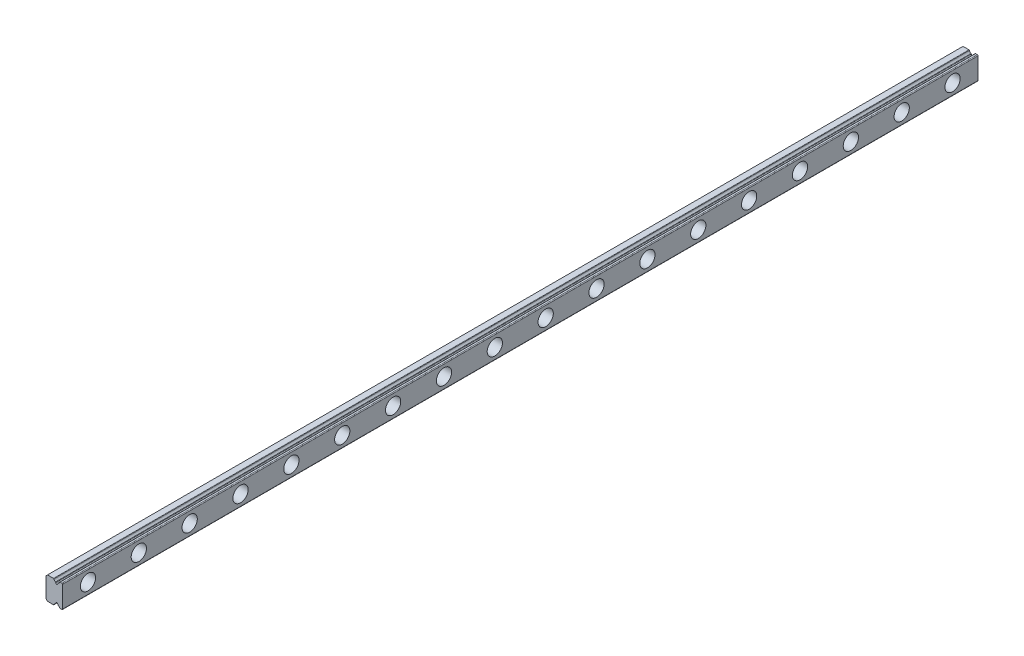
from build123d import *

# Parameters (mm, degrees)
EXTRUDE_1_DEPTH     = 360
SKETCH_2_R          = 3
CUT_EXTRUDE_1_DEPTH = 4.5
SKETCH_3_R          = 1.75
CUT_EXTRUDE_2_DEPTH = 361.140597545


with BuildPart() as part:
    # 草图1 → 凸台-拉伸1 (new body)
    with BuildSketch(Plane.XY):
        with BuildLine():
            ThreePointArc((6.2, 9), (6.412132034, 8.912132034), (6.5, 8.7))
            Line((6.5, 8.7), (6.5, 0.3))
            ThreePointArc((6.5, 0.3), (6.412132034, 0.087867966), (6.2, 0))
            Line((6.2, 0), (5.557669683, 0))
            ThreePointArc((5.557669683, 0), (5.444280341, 0.035249106), (5.370859728, 0.128571429))
            ThreePointArc((5.370859728, 0.128571429), (5.130846451, 0.514929157), (4.764285714, 0.784209483))
            ThreePointArc((4.764285714, 0.784209483), (4.680969149, 0.858006567), (4.65, 0.964911064))
            Line((4.65, 0.964911064), (4.65, 1))
            ThreePointArc((4.65, 1), (4.25, 1.4), (3.85, 1))
            Line((3.85, 1), (3.85, 0.964911064))
            ThreePointArc((3.85, 0.964911064), (3.819030851, 0.858006567), (3.735714286, 0.784209483))
            ThreePointArc((3.735714286, 0.784209483), (3.369153549, 0.514929157), (3.129140272, 0.128571429))
            ThreePointArc((3.129140272, 0.128571429), (3.055719659, 0.035249106), (2.942330317, 0))
            Line((2.942330317, 0), (0.6, 0))
            Line((0.6, 0), (0, 0.6))
            Line((0, 0.6), (0, 8.4))
            Line((0, 8.4), (0.6, 9))
            Line((0.6, 9), (2.942330317, 9))
            ThreePointArc((2.942330317, 9), (3.055719659, 8.964750894), (3.129140272, 8.871428571))
            ThreePointArc((3.129140272, 8.871428571), (3.369153549, 8.485070843), (3.735714286, 8.215790517))
            ThreePointArc((3.735714286, 8.215790517), (3.819030851, 8.141993433), (3.85, 8.035088936))
            Line((3.85, 8.035088936), (3.85, 8))
            ThreePointArc((3.85, 8), (4.25, 7.6), (4.65, 8))
            Line((4.65, 8), (4.65, 8.035088936))
            ThreePointArc((4.65, 8.035088936), (4.680969149, 8.141993433), (4.764285714, 8.215790517))
            ThreePointArc((4.764285714, 8.215790517), (5.130846451, 8.485070843), (5.370859728, 8.871428571))
            ThreePointArc((5.370859728, 8.871428571), (5.444280341, 8.964750894), (5.557669683, 9))
            Line((5.557669683, 9), (6.2, 9))
        make_face()
    extrude(amount=EXTRUDE_1_DEPTH)

    # 草图2 → 切除-拉伸1 (cut)
    with BuildSketch(Plane(origin=(6.5, 0, 0), x_dir=(0, 0, -1), z_dir=(1, 0, 0))):
        with Locations((-10, 4.5)):
            Circle(SKETCH_2_R)
        with Locations((-30, 4.5)):
            Circle(SKETCH_2_R)
        with Locations((-50, 4.5)):
            Circle(SKETCH_2_R)
        with Locations((-70, 4.5)):
            Circle(SKETCH_2_R)
        with Locations((-90, 4.5)):
            Circle(SKETCH_2_R)
        with Locations((-110, 4.5)):
            Circle(SKETCH_2_R)
        with Locations((-130, 4.5)):
            Circle(SKETCH_2_R)
        with Locations((-150, 4.5)):
            Circle(SKETCH_2_R)
        with Locations((-170, 4.5)):
            Circle(SKETCH_2_R)
        with Locations((-190, 4.5)):
            Circle(SKETCH_2_R)
        with Locations((-210, 4.5)):
            Circle(SKETCH_2_R)
        with Locations((-230, 4.5)):
            Circle(SKETCH_2_R)
        with Locations((-250, 4.5)):
            Circle(SKETCH_2_R)
        with Locations((-270, 4.5)):
            Circle(SKETCH_2_R)
        with Locations((-290, 4.5)):
            Circle(SKETCH_2_R)
        with Locations((-310, 4.5)):
            Circle(SKETCH_2_R)
        with Locations((-330, 4.5)):
            Circle(SKETCH_2_R)
        with Locations((-350, 4.5)):
            Circle(SKETCH_2_R)
        with Locations((-370, 4.5)):
            Circle(SKETCH_2_R)
        with Locations((-390, 4.5)):
            Circle(SKETCH_2_R)
        with Locations((-410, 4.5)):
            Circle(SKETCH_2_R)
        with Locations((-430, 4.5)):
            Circle(SKETCH_2_R)
        with Locations((-450, 4.5)):
            Circle(SKETCH_2_R)
        with Locations((-470, 4.5)):
            Circle(SKETCH_2_R)
        with Locations((-490, 4.5)):
            Circle(SKETCH_2_R)
        with Locations((-510, 4.5)):
            Circle(SKETCH_2_R)
        with Locations((-530, 4.5)):
            Circle(SKETCH_2_R)
        with Locations((-550, 4.5)):
            Circle(SKETCH_2_R)
        with Locations((-570, 4.5)):
            Circle(SKETCH_2_R)
        with Locations((-590, 4.5)):
            Circle(SKETCH_2_R)
        with Locations((-610, 4.5)):
            Circle(SKETCH_2_R)
        with Locations((-630, 4.5)):
            Circle(SKETCH_2_R)
        with Locations((-650, 4.5)):
            Circle(SKETCH_2_R)
        with Locations((-670, 4.5)):
            Circle(SKETCH_2_R)
        with Locations((-690, 4.5)):
            Circle(SKETCH_2_R)
        with Locations((-710, 4.5)):
            Circle(SKETCH_2_R)
        with Locations((-730, 4.5)):
            Circle(SKETCH_2_R)
        with Locations((-750, 4.5)):
            Circle(SKETCH_2_R)
        with Locations((-770, 4.5)):
            Circle(SKETCH_2_R)
        with Locations((-790, 4.5)):
            Circle(SKETCH_2_R)
        with Locations((-810, 4.5)):
            Circle(SKETCH_2_R)
        with Locations((-830, 4.5)):
            Circle(SKETCH_2_R)
        with Locations((-850, 4.5)):
            Circle(SKETCH_2_R)
        with Locations((-870, 4.5)):
            Circle(SKETCH_2_R)
        with Locations((-890, 4.5)):
            Circle(SKETCH_2_R)
        with Locations((-910, 4.5)):
            Circle(SKETCH_2_R)
        with Locations((-930, 4.5)):
            Circle(SKETCH_2_R)
        with Locations((-950, 4.5)):
            Circle(SKETCH_2_R)
        with Locations((-970, 4.5)):
            Circle(SKETCH_2_R)
        with Locations((-990, 4.5)):
            Circle(SKETCH_2_R)
        with Locations((-1010, 4.5)):
            Circle(SKETCH_2_R)
        with Locations((-1030, 4.5)):
            Circle(SKETCH_2_R)
        with Locations((-1050, 4.5)):
            Circle(SKETCH_2_R)
        with Locations((-1070, 4.5)):
            Circle(SKETCH_2_R)
        with Locations((-1090, 4.5)):
            Circle(SKETCH_2_R)
        with Locations((-1110, 4.5)):
            Circle(SKETCH_2_R)
        with Locations((-1130, 4.5)):
            Circle(SKETCH_2_R)
        with Locations((-1150, 4.5)):
            Circle(SKETCH_2_R)
        with Locations((-1170, 4.5)):
            Circle(SKETCH_2_R)
        with Locations((-1190, 4.5)):
            Circle(SKETCH_2_R)
        with Locations((-1210, 4.5)):
            Circle(SKETCH_2_R)
        with Locations((-1230, 4.5)):
            Circle(SKETCH_2_R)
        with Locations((-1250, 4.5)):
            Circle(SKETCH_2_R)
        with Locations((-1270, 4.5)):
            Circle(SKETCH_2_R)
        with Locations((-1290, 4.5)):
            Circle(SKETCH_2_R)
        with Locations((-1310, 4.5)):
            Circle(SKETCH_2_R)
        with Locations((-1330, 4.5)):
            Circle(SKETCH_2_R)
        with Locations((-1350, 4.5)):
            Circle(SKETCH_2_R)
        with Locations((-1370, 4.5)):
            Circle(SKETCH_2_R)
        with Locations((-1390, 4.5)):
            Circle(SKETCH_2_R)
        with Locations((-1410, 4.5)):
            Circle(SKETCH_2_R)
        with Locations((-1430, 4.5)):
            Circle(SKETCH_2_R)
        with Locations((-1450, 4.5)):
            Circle(SKETCH_2_R)
        with Locations((-1470, 4.5)):
            Circle(SKETCH_2_R)
        with Locations((-1490, 4.5)):
            Circle(SKETCH_2_R)
        with Locations((-1510, 4.5)):
            Circle(SKETCH_2_R)
        with Locations((-1530, 4.5)):
            Circle(SKETCH_2_R)
        with Locations((-1550, 4.5)):
            Circle(SKETCH_2_R)
        with Locations((-1570, 4.5)):
            Circle(SKETCH_2_R)
        with Locations((-1590, 4.5)):
            Circle(SKETCH_2_R)
        with Locations((-1610, 4.5)):
            Circle(SKETCH_2_R)
        with Locations((-1630, 4.5)):
            Circle(SKETCH_2_R)
        with Locations((-1650, 4.5)):
            Circle(SKETCH_2_R)
        with Locations((-1670, 4.5)):
            Circle(SKETCH_2_R)
        with Locations((-1690, 4.5)):
            Circle(SKETCH_2_R)
        with Locations((-1710, 4.5)):
            Circle(SKETCH_2_R)
        with Locations((-1730, 4.5)):
            Circle(SKETCH_2_R)
        with Locations((-1750, 4.5)):
            Circle(SKETCH_2_R)
        with Locations((-1770, 4.5)):
            Circle(SKETCH_2_R)
        with Locations((-1790, 4.5)):
            Circle(SKETCH_2_R)
        with Locations((-1810, 4.5)):
            Circle(SKETCH_2_R)
        with Locations((-1830, 4.5)):
            Circle(SKETCH_2_R)
        with Locations((-1850, 4.5)):
            Circle(SKETCH_2_R)
        with Locations((-1870, 4.5)):
            Circle(SKETCH_2_R)
        with Locations((-1890, 4.5)):
            Circle(SKETCH_2_R)
        with Locations((-1910, 4.5)):
            Circle(SKETCH_2_R)
        with Locations((-1930, 4.5)):
            Circle(SKETCH_2_R)
        with Locations((-1950, 4.5)):
            Circle(SKETCH_2_R)
        with Locations((-1970, 4.5)):
            Circle(SKETCH_2_R)
        with Locations((-1990, 4.5)):
            Circle(SKETCH_2_R)
        with Locations((-2010, 4.5)):
            Circle(SKETCH_2_R)
        with Locations((-2030, 4.5)):
            Circle(SKETCH_2_R)
        with Locations((-2050, 4.5)):
            Circle(SKETCH_2_R)
        with Locations((-2070, 4.5)):
            Circle(SKETCH_2_R)
        with Locations((-2090, 4.5)):
            Circle(SKETCH_2_R)
        with Locations((-2110, 4.5)):
            Circle(SKETCH_2_R)
        with Locations((-2130, 4.5)):
            Circle(SKETCH_2_R)
        with Locations((-2150, 4.5)):
            Circle(SKETCH_2_R)
        with Locations((-2170, 4.5)):
            Circle(SKETCH_2_R)
        with Locations((-2190, 4.5)):
            Circle(SKETCH_2_R)
        with Locations((-2210, 4.5)):
            Circle(SKETCH_2_R)
        with Locations((-2230, 4.5)):
            Circle(SKETCH_2_R)
        with Locations((-2250, 4.5)):
            Circle(SKETCH_2_R)
        with Locations((-2270, 4.5)):
            Circle(SKETCH_2_R)
        with Locations((-2290, 4.5)):
            Circle(SKETCH_2_R)
        with Locations((-2310, 4.5)):
            Circle(SKETCH_2_R)
        with Locations((-2330, 4.5)):
            Circle(SKETCH_2_R)
        with Locations((-2350, 4.5)):
            Circle(SKETCH_2_R)
        with Locations((-2370, 4.5)):
            Circle(SKETCH_2_R)
        with Locations((-2390, 4.5)):
            Circle(SKETCH_2_R)
        with Locations((-2410, 4.5)):
            Circle(SKETCH_2_R)
        with Locations((-2430, 4.5)):
            Circle(SKETCH_2_R)
        with Locations((-2450, 4.5)):
            Circle(SKETCH_2_R)
        with Locations((-2470, 4.5)):
            Circle(SKETCH_2_R)
    extrude(amount=-CUT_EXTRUDE_1_DEPTH, mode=Mode.SUBTRACT)

    # 草图3 → 切除-拉伸2 (cut, through all)
    with BuildSketch(Plane(origin=(2, 0, 0), x_dir=(0, 0, -1), z_dir=(1, 0, 0))):
        with Locations((-10, 4.5)):
            Circle(SKETCH_3_R)
        with Locations((-30, 4.5)):
            Circle(SKETCH_3_R)
        with Locations((-50, 4.5)):
            Circle(SKETCH_3_R)
        with Locations((-70, 4.5)):
            Circle(SKETCH_3_R)
        with Locations((-90, 4.5)):
            Circle(SKETCH_3_R)
        with Locations((-110, 4.5)):
            Circle(SKETCH_3_R)
        with Locations((-130, 4.5)):
            Circle(SKETCH_3_R)
        with Locations((-150, 4.5)):
            Circle(SKETCH_3_R)
        with Locations((-170, 4.5)):
            Circle(SKETCH_3_R)
        with Locations((-190, 4.5)):
            Circle(SKETCH_3_R)
        with Locations((-210, 4.5)):
            Circle(SKETCH_3_R)
        with Locations((-230, 4.5)):
            Circle(SKETCH_3_R)
        with Locations((-250, 4.5)):
            Circle(SKETCH_3_R)
        with Locations((-270, 4.5)):
            Circle(SKETCH_3_R)
        with Locations((-290, 4.5)):
            Circle(SKETCH_3_R)
        with Locations((-310, 4.5)):
            Circle(SKETCH_3_R)
        with Locations((-330, 4.5)):
            Circle(SKETCH_3_R)
        with Locations((-350, 4.5)):
            Circle(SKETCH_3_R)
        with Locations((-370, 4.5)):
            Circle(SKETCH_3_R)
        with Locations((-390, 4.5)):
            Circle(SKETCH_3_R)
        with Locations((-410, 4.5)):
            Circle(SKETCH_3_R)
        with Locations((-430, 4.5)):
            Circle(SKETCH_3_R)
        with Locations((-450, 4.5)):
            Circle(SKETCH_3_R)
        with Locations((-470, 4.5)):
            Circle(SKETCH_3_R)
        with Locations((-490, 4.5)):
            Circle(SKETCH_3_R)
        with Locations((-510, 4.5)):
            Circle(SKETCH_3_R)
        with Locations((-530, 4.5)):
            Circle(SKETCH_3_R)
        with Locations((-550, 4.5)):
            Circle(SKETCH_3_R)
        with Locations((-570, 4.5)):
            Circle(SKETCH_3_R)
        with Locations((-590, 4.5)):
            Circle(SKETCH_3_R)
        with Locations((-610, 4.5)):
            Circle(SKETCH_3_R)
        with Locations((-630, 4.5)):
            Circle(SKETCH_3_R)
        with Locations((-650, 4.5)):
            Circle(SKETCH_3_R)
        with Locations((-670, 4.5)):
            Circle(SKETCH_3_R)
        with Locations((-690, 4.5)):
            Circle(SKETCH_3_R)
        with Locations((-710, 4.5)):
            Circle(SKETCH_3_R)
        with Locations((-730, 4.5)):
            Circle(SKETCH_3_R)
        with Locations((-750, 4.5)):
            Circle(SKETCH_3_R)
        with Locations((-770, 4.5)):
            Circle(SKETCH_3_R)
        with Locations((-790, 4.5)):
            Circle(SKETCH_3_R)
        with Locations((-810, 4.5)):
            Circle(SKETCH_3_R)
        with Locations((-830, 4.5)):
            Circle(SKETCH_3_R)
        with Locations((-850, 4.5)):
            Circle(SKETCH_3_R)
        with Locations((-870, 4.5)):
            Circle(SKETCH_3_R)
        with Locations((-890, 4.5)):
            Circle(SKETCH_3_R)
        with Locations((-910, 4.5)):
            Circle(SKETCH_3_R)
        with Locations((-930, 4.5)):
            Circle(SKETCH_3_R)
        with Locations((-950, 4.5)):
            Circle(SKETCH_3_R)
        with Locations((-970, 4.5)):
            Circle(SKETCH_3_R)
        with Locations((-990, 4.5)):
            Circle(SKETCH_3_R)
        with Locations((-1010, 4.5)):
            Circle(SKETCH_3_R)
        with Locations((-1030, 4.5)):
            Circle(SKETCH_3_R)
        with Locations((-1050, 4.5)):
            Circle(SKETCH_3_R)
        with Locations((-1070, 4.5)):
            Circle(SKETCH_3_R)
    extrude(amount=-CUT_EXTRUDE_2_DEPTH, mode=Mode.SUBTRACT)


solid = part.part
